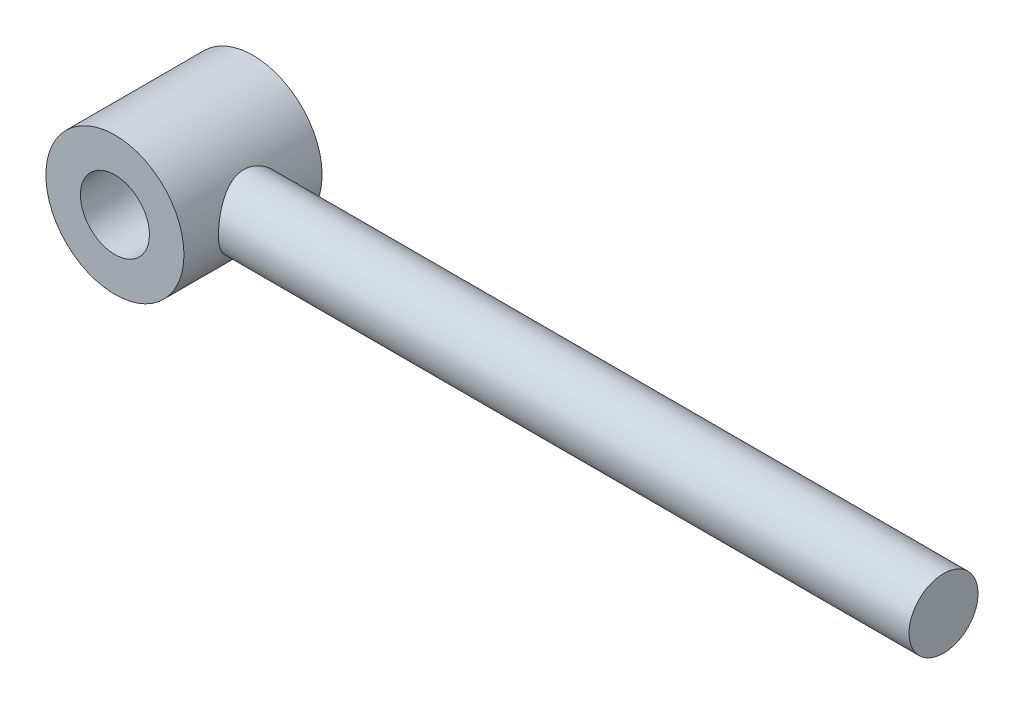
from build123d import *

# Parameters (mm, degrees)
SCHIZZO1_R                        = 10
SCHIZZO1_R_2                      = 5
ESTRUSIONE_ESTRUSIONE1_DEPTH      = 20
ESTRUSIONE_ESTRUSIONE2_REACH      = 124.066
ESTRUSIONE_ESTRUSIONE2_END_RADIUS = 10
SCHIZZO2_R                        = 5


with BuildPart() as part:
    # Schizzo1 → Estrusione-Estrusione1 (new body)
    with BuildSketch(Plane.XY):
        Circle(SCHIZZO1_R)
        Circle(SCHIZZO1_R_2, mode=Mode.SUBTRACT)
    extrude(amount=ESTRUSIONE_ESTRUSIONE1_DEPTH)

    # Estrusione-Estrusione2: up to this cylinder (the profile starts outside it)
    estrusione_estrusione2_end = Plane(origin=(0, 0, 10), z_dir=(0, 0, -1)) * Cylinder(ESTRUSIONE_ESTRUSIONE2_END_RADIUS, 269.132, mode=Mode.PRIVATE)
    # Schizzo2 → Estrusione-Estrusione2 (add, up to the surface)
    with BuildSketch(Plane.ZY.offset(-110), mode=Mode.PRIVATE) as estrusione_estrusione2_sk1:
        with Locations((10, 0)):
            Circle(SCHIZZO2_R)
    estrusione_estrusione2_tool1 = extrude(estrusione_estrusione2_sk1.sketch, amount=ESTRUSIONE_ESTRUSIONE2_REACH, mode=Mode.PRIVATE) - estrusione_estrusione2_end
    add(estrusione_estrusione2_tool1.solids().sort_by_distance((110, 0, 10))[0])


solid = part.part
